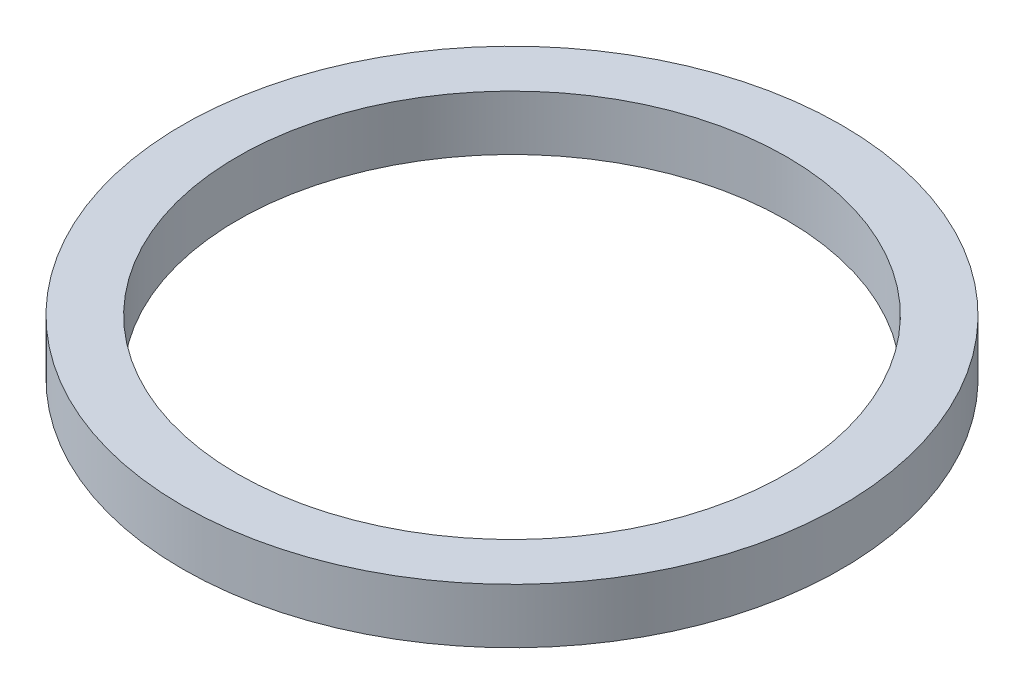
from build123d import *

# Parameters (mm, degrees)
SKETCH1_R           = 2.4
SKETCH1_R_2         = 2
BOSS_EXTRUDE2_DEPTH = 0.4


with BuildPart() as part:
    # Sketch1 → Boss-Extrude2 (new body)
    with BuildSketch(Plane(origin=(0, 0, 0), x_dir=(1, 0, 0), z_dir=(0, 1, 0))):
        with Locations(Location((-59.666580909, 25.761749574, 0), (0, 0, 270))):
            Circle(SKETCH1_R)
        with Locations(Location((-59.666580909, 25.761749574, 0), (0, 0, 270))):
            Circle(SKETCH1_R_2, mode=Mode.SUBTRACT)
    extrude(amount=BOSS_EXTRUDE2_DEPTH)


solid = part.part
